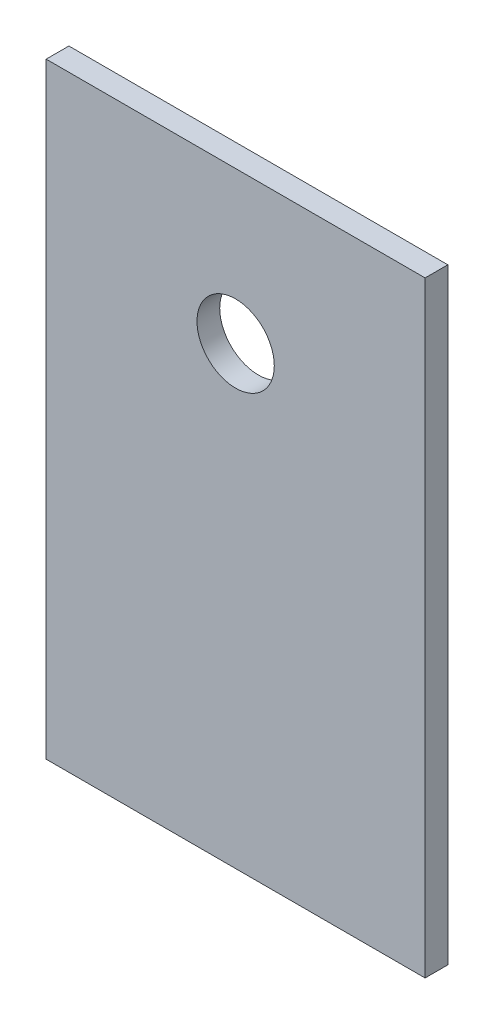
from build123d import *

# Parameters (mm, degrees)
SZKIC1_W                    = 50
SZKIC1_H                    = 80
DODANIE_WYCI_GNI_CIE1_DEPTH = 3
OTW_R_GWINTOWANY_M121_D     = 10.2
OTW_R_GWINTOWANY_M121_DEPTH = 32.75
OTW_R_GWINTOWANY_M121_TIP   = 3.064389157


with BuildPart() as part:
    # Szkic1 → Dodanie-wyciągnięcie1 (new body)
    with BuildSketch(Plane.XY):
        Rectangle(SZKIC1_W, SZKIC1_H)
    extrude(amount=DODANIE_WYCI_GNI_CIE1_DEPTH)

    # Otwór gwintowany M121
    with Locations(Plane.XY.offset(3)):
        with Locations((0, 20)):
            Hole(OTW_R_GWINTOWANY_M121_D / 2, depth=OTW_R_GWINTOWANY_M121_DEPTH)
            with Locations((0, 0, -(OTW_R_GWINTOWANY_M121_DEPTH + OTW_R_GWINTOWANY_M121_TIP / 2))):  # 118° drill point
                Cone(0, OTW_R_GWINTOWANY_M121_D / 2, OTW_R_GWINTOWANY_M121_TIP, mode=Mode.SUBTRACT)


solid = part.part
